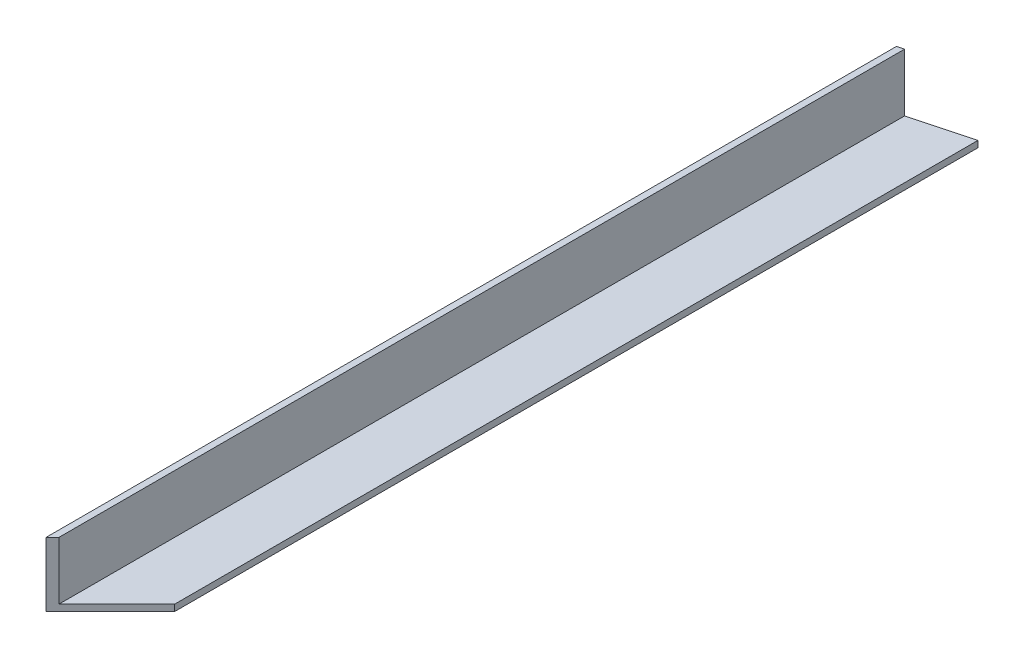
from build123d import *

# Parameters (mm, degrees)
BOSS_EXTRUDE1_DEPTH     = 171.45
CUT_EXTRUDE2_DEPTH      = 173.299266975
CUT_EXTRUDE2_DEPTH_BACK = 173.299266975


with BuildPart() as part:
    # Sketch1 → Boss-Extrude1 (new body)
    with BuildSketch(Plane.XY):
        Polygon((0, 0), (0, 12.7), (1.27, 12.7), (1.27, 1.27), (12.7, 1.27), (12.7, 0), align=None)
    extrude(amount=BOSS_EXTRUDE1_DEPTH)

    # Sketch3 → Cut-Extrude2 (cut, two sides: drawn at the far end of the back side and taken through both)
    with BuildSketch(Plane(origin=(0, 1.27, 0), x_dir=(1, 0, 0), z_dir=(0, 1, 0)).offset(-CUT_EXTRUDE2_DEPTH_BACK)):
        Polygon((0, -171.45), (12.7, -158.75), (12.7, -171.45), align=None)
        Polygon((12.7, 0), (0, -3.402954744), (0, 0), align=None)
    extrude(amount=CUT_EXTRUDE2_DEPTH + CUT_EXTRUDE2_DEPTH_BACK, mode=Mode.SUBTRACT)


solid = part.part
